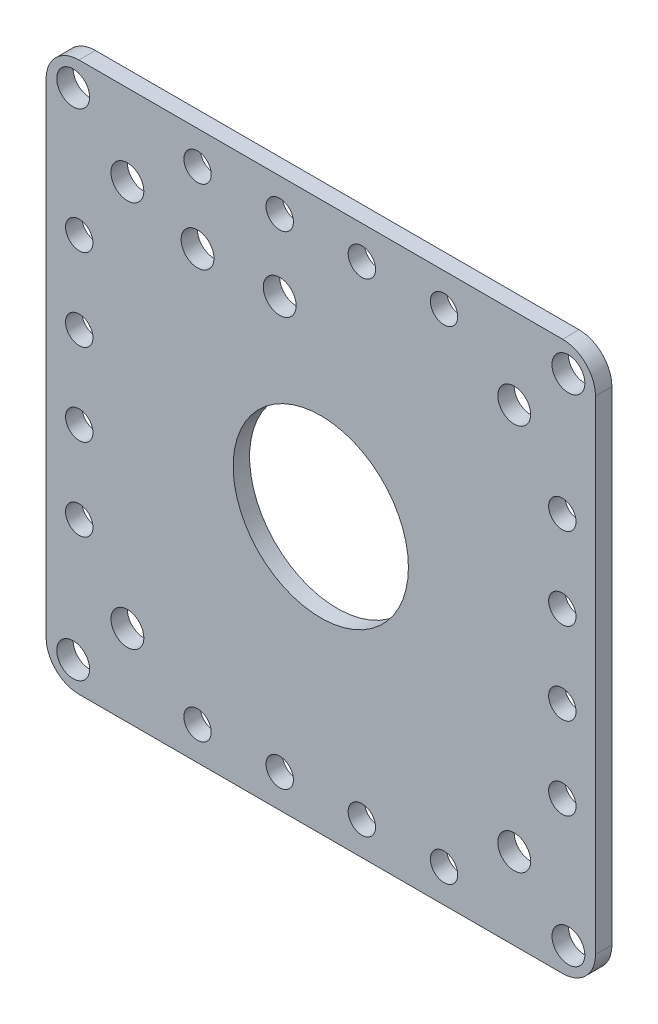
from build123d import *

# Parameters (mm, degrees)
SKETCH1_R           = 8
SKETCH1_R_2         = 1.5
SKETCH1_R_3         = 1.25
BOSS_EXTRUDE1_DEPTH = 1.5


with BuildPart() as part:
    # Sketch1 → Boss-Extrude1 (new body)
    with BuildSketch(Plane.XY):
        with BuildLine():
            Line((-22.075, -25.075), (22.075, -25.075))
            ThreePointArc((22.075, -25.075), (24.196320344, -24.196320344), (25.075, -22.075))
            Line((25.075, -22.075), (25.075, 22.075))
            ThreePointArc((25.075, 22.075), (24.196320344, 24.196320344), (22.075, 25.075))
            Line((22.075, 25.075), (-22.075, 25.075))
            ThreePointArc((-22.075, 25.075), (-24.196320344, 24.196320344), (-25.075, 22.075))
            Line((-25.075, 22.075), (-25.075, -22.075))
            ThreePointArc((-25.075, -22.075), (-24.196320344, -24.196320344), (-22.075, -25.075))
        make_face()
        Circle(SKETCH1_R, mode=Mode.SUBTRACT)
        with Locations((-22.605330086, 22.605330086)):
            Circle(SKETCH1_R_2, mode=Mode.SUBTRACT)
        with Locations(Location((22.605330086, -22.605330086, 0), (0, 0, 180))):
            Circle(SKETCH1_R_2, mode=Mode.SUBTRACT)
        with Locations((22.605330086, 22.605330086)):
            Circle(SKETCH1_R_2, mode=Mode.SUBTRACT)
        with Locations(Location((-22.605330086, -22.605330086, 0), (0, 0, 180))):
            Circle(SKETCH1_R_2, mode=Mode.SUBTRACT)
        with Locations((-17.655582618, 17.655582618)):
            Circle(SKETCH1_R_2, mode=Mode.SUBTRACT)
        with Locations(Location((17.655582618, -17.655582618, 0), (0, 0, 180))):
            Circle(SKETCH1_R_2, mode=Mode.SUBTRACT)
        with Locations((17.655582618, 17.655582618)):
            Circle(SKETCH1_R_2, mode=Mode.SUBTRACT)
        with Locations(Location((-17.655582618, -17.655582618, 0), (0, 0, 180))):
            Circle(SKETCH1_R_2, mode=Mode.SUBTRACT)
        with Locations((-3.75, 22.05)):
            Circle(SKETCH1_R_3, mode=Mode.SUBTRACT)
        with Locations((3.75, 22.05)):
            Circle(SKETCH1_R_3, mode=Mode.SUBTRACT)
        with Locations((11.25, 22.05)):
            Circle(SKETCH1_R_3, mode=Mode.SUBTRACT)
        with Locations((-11.25, 22.05)):
            Circle(SKETCH1_R_3, mode=Mode.SUBTRACT)
        with Locations(Location((11.25, -22.05, 0), (0, 0, 180))):
            Circle(SKETCH1_R_3, mode=Mode.SUBTRACT)
        with Locations(Location((3.75, -22.05, 0), (0, 0, 180))):
            Circle(SKETCH1_R_3, mode=Mode.SUBTRACT)
        with Locations(Location((-3.75, -22.05, 0), (0, 0, 180))):
            Circle(SKETCH1_R_3, mode=Mode.SUBTRACT)
        with Locations(Location((-11.25, -22.05, 0), (0, 0, 180))):
            Circle(SKETCH1_R_3, mode=Mode.SUBTRACT)
        with Locations(Location((-22.05, 3.75, 0), (0, 0, 180))):
            Circle(SKETCH1_R_3, mode=Mode.SUBTRACT)
        with Locations(Location((-22.05, 11.25, 0), (0, 0, 180))):
            Circle(SKETCH1_R_3, mode=Mode.SUBTRACT)
        with Locations((-22.05, -11.25)):
            Circle(SKETCH1_R_3, mode=Mode.SUBTRACT)
        with Locations((-22.05, -3.75)):
            Circle(SKETCH1_R_3, mode=Mode.SUBTRACT)
        with Locations(Location((22.05, -11.25, 0), (0, 0, 180))):
            Circle(SKETCH1_R_3, mode=Mode.SUBTRACT)
        with Locations(Location((22.05, -3.75, 0), (0, 0, 180))):
            Circle(SKETCH1_R_3, mode=Mode.SUBTRACT)
        with Locations((22.05, 3.75)):
            Circle(SKETCH1_R_3, mode=Mode.SUBTRACT)
        with Locations((22.05, 11.25)):
            Circle(SKETCH1_R_3, mode=Mode.SUBTRACT)
        with Locations((-11.25, 15.55)):
            Circle(SKETCH1_R_2, mode=Mode.SUBTRACT)
        with Locations((-3.75, 15.55)):
            Circle(SKETCH1_R_2, mode=Mode.SUBTRACT)
    extrude(amount=BOSS_EXTRUDE1_DEPTH)


solid = part.part
